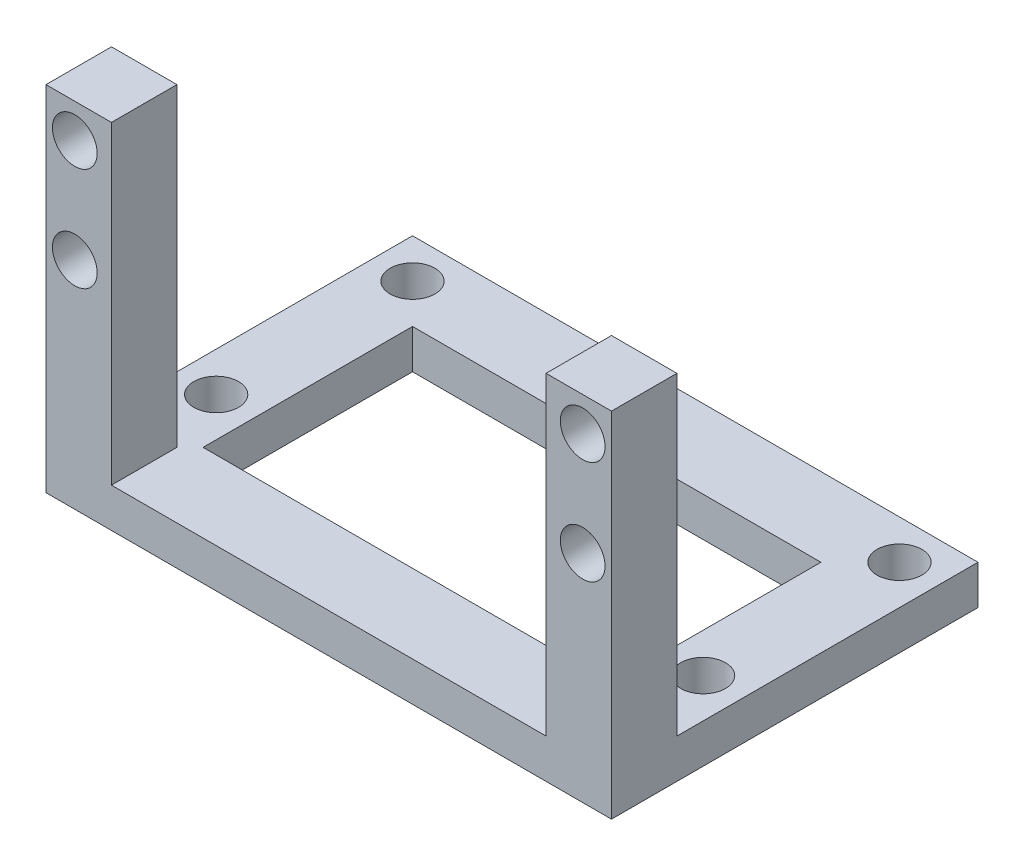
from build123d import *

# Parameters (mm, degrees)
SKETCH1_W           = 54.864
SKETCH1_H           = 35.56
BOSS_EXTRUDE1_DEPTH = 3.81
SKETCH2_R           = 2.1717
SKETCH2_W           = 39.624
SKETCH2_H           = 20.32
CUT_EXTRUDE2_DEPTH  = 3.81
SKETCH3_W           = 6.35
SKETCH3_H           = 6.352840925
SKETCH3_H_2         = 6.35
BOSS_EXTRUDE2_DEPTH = 30.48
SKETCH4_R           = 2.1717
CUT_EXTRUDE3_DEPTH  = 6.35


with BuildPart() as part:
    # Sketch1 → Boss-Extrude1 (new body)
    with BuildSketch(Plane(origin=(0, 0, 0), x_dir=(1, 0, 0), z_dir=(0, 1, 0))):
        with Locations((2.806390244, -14.88997561)):
            Rectangle(SKETCH1_W, SKETCH1_H)
    extrude(amount=BOSS_EXTRUDE1_DEPTH)

    # Sketch2 → Cut-Extrude2 (cut)
    with BuildSketch(Plane(origin=(0, 3.81, 0), x_dir=(1, 0, 0), z_dir=(0, 1, 0))):
        with Locations(Location((-20.815609756, -0.91997561, 0), (0, 0, 270))):
            Circle(SKETCH2_R)
        with Locations(Location((-20.815609756, -19.96997561, 0), (0, 0, 270))):
            Circle(SKETCH2_R)
        with Locations(Location((26.428390244, -19.96997561, 0), (0, 0, 270))):
            Circle(SKETCH2_R)
        with Locations(Location((26.428390244, -0.91997561, 0), (0, 0, 270))):
            Circle(SKETCH2_R)
        with Locations((2.806390244, -14.88997561)):
            Rectangle(SKETCH2_W, SKETCH2_H)
    extrude(amount=-CUT_EXTRUDE2_DEPTH, mode=Mode.SUBTRACT)

    # Sketch3 → Boss-Extrude2 (add)
    with BuildSketch(Plane(origin=(0, 3.81, 0), x_dir=(1, 0, 0), z_dir=(0, 1, 0))):
        with Locations((-21.450609756, -29.493555148)):
            Rectangle(SKETCH3_W, SKETCH3_H)
        with Locations((27.063390244, -29.49497561)):
            Rectangle(SKETCH3_W, SKETCH3_H_2)
    extrude(amount=BOSS_EXTRUDE2_DEPTH)

    # Sketch4 → Cut-Extrude3 (cut)
    with BuildSketch(Plane.XY.offset(32.66997561)):
        with Locations((-21.831609756, 30.988)):
            Circle(SKETCH4_R)
        with Locations((-21.831609756, 20.955)):
            Circle(SKETCH4_R)
        with Locations((27.444390244, 30.988)):
            Circle(SKETCH4_R)
        with Locations((27.444390244, 20.955)):
            Circle(SKETCH4_R)
    extrude(amount=-CUT_EXTRUDE3_DEPTH, mode=Mode.SUBTRACT)


solid = part.part
